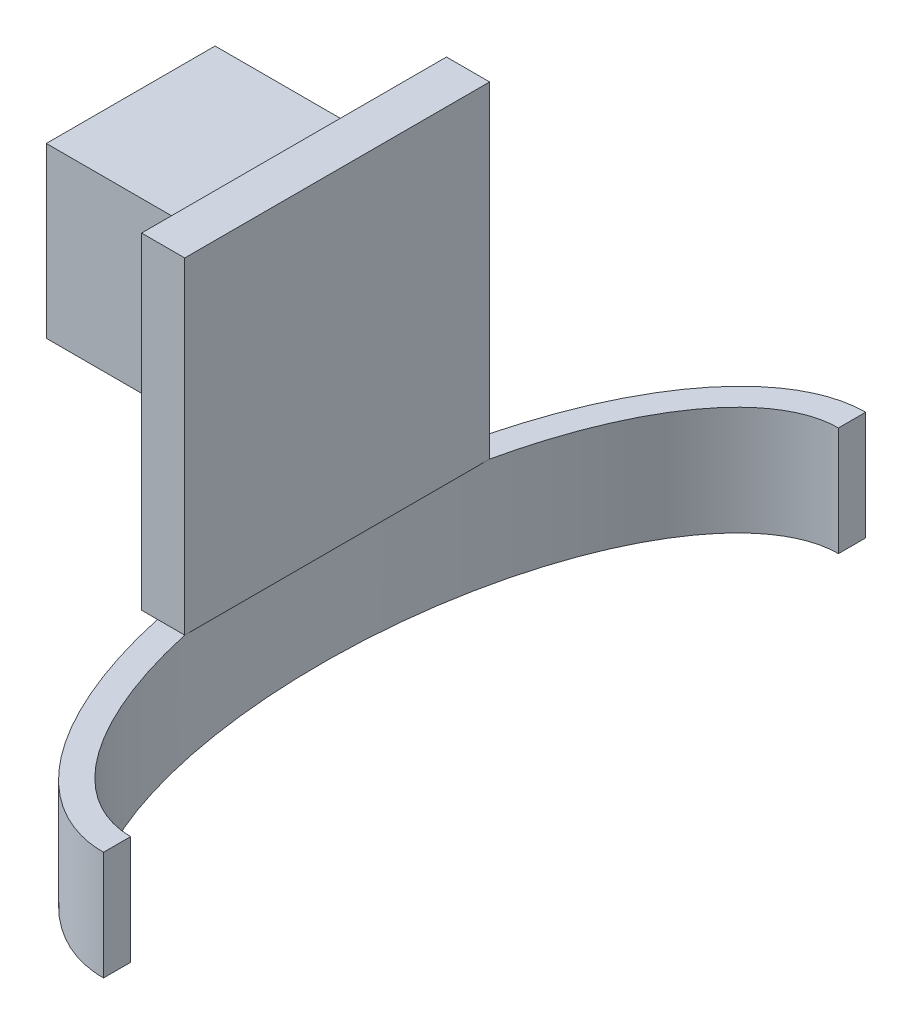
from build123d import *

# Parameters (mm, degrees)
BOSS_EXTRUDE1_DEPTH = 2
SKETCH2_W           = 0.792613654
SKETCH2_H           = 5.6
BOSS_EXTRUDE2_DEPTH = 6
SKETCH3_W           = 3.1
SKETCH3_H           = 3.1
BOSS_EXTRUDE3_DEPTH = 3


with BuildPart() as part:
    # Sketch1 → Boss-Extrude1 (new body)
    with BuildSketch(Plane(origin=(0, 0, 0), x_dir=(1, 0, 0), z_dir=(0, 1, 0))):
        with BuildLine():
            add(Edge.make_bspline(
                [(0, 6.5), (-3, 6.5), (-3, 0), (-3, -6.5), (0, -6.5)],
                knots=[0, 0, 0, 1.570796327, 1.570796327, 3.141592654, 3.141592654, 3.141592654], degree=2, weights=[1, 0.707106781, 1, 0.707106781, 1]))
            Line((0, -6.5), (0, -7))
            add(Edge.make_bspline(
                [(0, 7), (-3.5, 7), (-3.5, 0), (-3.5, -7), (0, -7)],
                knots=[3.141592654, 3.141592654, 3.141592654, 4.71238898, 4.71238898, 6.283185307, 6.283185307, 6.283185307], degree=2, weights=[1, 0.707106781, 1, 0.707106781, 1]))
            Line((0, 7), (0, 6.5))
        make_face()
    extrude(amount=BOSS_EXTRUDE1_DEPTH)

    # Sketch2 → Boss-Extrude2 (add)
    with BuildSketch(Plane(origin=(0, 2, 0), x_dir=(1, 0, 0), z_dir=(0, 1, 0))):
        with Locations((-3.103693173, 0)):
            Rectangle(SKETCH2_W, SKETCH2_H)
    extrude(amount=BOSS_EXTRUDE2_DEPTH)

    # Sketch3 → Boss-Extrude3 (add)
    with BuildSketch(Plane.ZY.offset(3.5)):
        with Locations((0, 5.75)):
            Rectangle(SKETCH3_W, SKETCH3_H)
    extrude(amount=BOSS_EXTRUDE3_DEPTH)


solid = part.part
